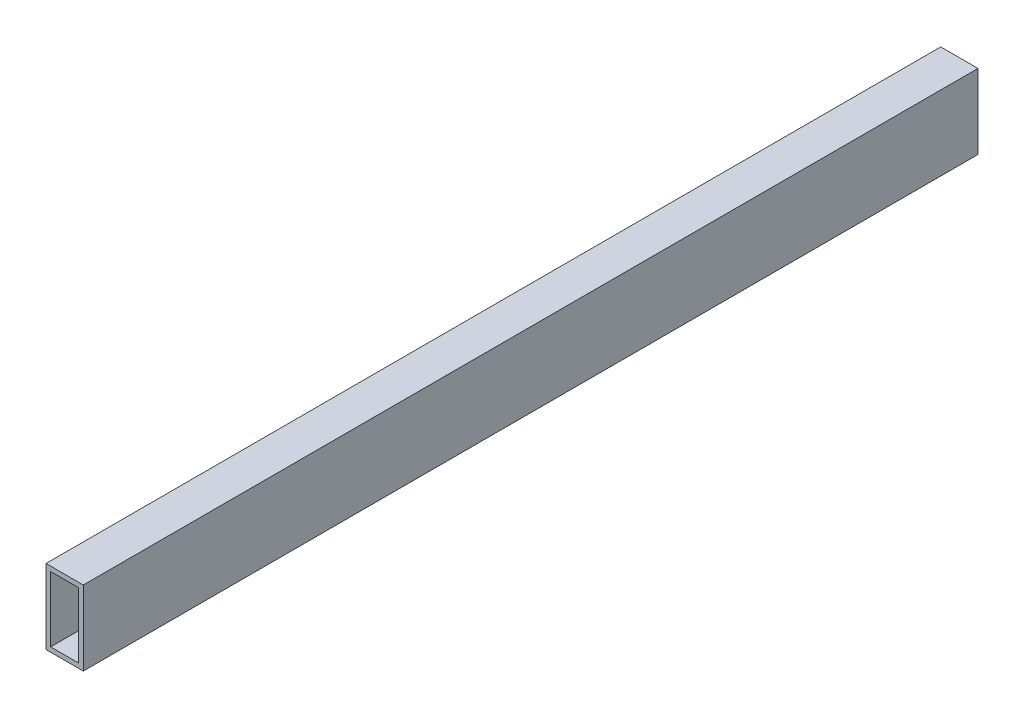
from build123d import *

# Parameters (mm, degrees)
SKETCH1_W           = 25.4
SKETCH1_H           = 50.8
SKETCH1_W_2         = 19.05
SKETCH1_H_2         = 44.45
BOSS_EXTRUDE1_DEPTH = 609.6


with BuildPart() as part:
    # Sketch1 → Boss-Extrude1 (new body)
    with BuildSketch(Plane.XY):
        with Locations((12.7, 25.4)):
            Rectangle(SKETCH1_W, SKETCH1_H)
        with Locations((12.7, 25.4)):
            Rectangle(SKETCH1_W_2, SKETCH1_H_2, mode=Mode.SUBTRACT)
    extrude(amount=BOSS_EXTRUDE1_DEPTH)


solid = part.part
